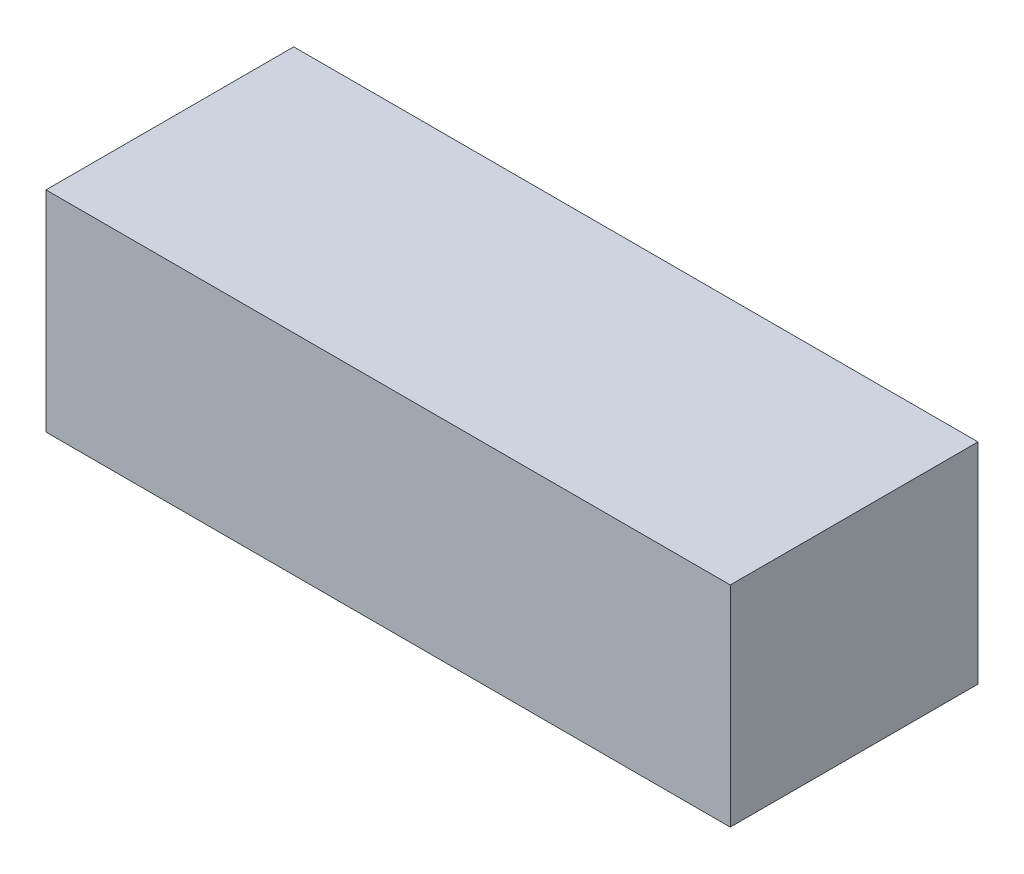
from build123d import *

# Parameters (mm, degrees)
SKETCH1_W           = 137
SKETCH1_H           = 42
BOSS_EXTRUDE1_DEPTH = 49.6


with BuildPart() as part:
    # Sketch1 → Boss-Extrude1 (new body)
    with BuildSketch(Plane.XY):
        with Locations((23.895505155, -12.653690722)):
            Rectangle(SKETCH1_W, SKETCH1_H)
    extrude(amount=BOSS_EXTRUDE1_DEPTH)


solid = part.part
